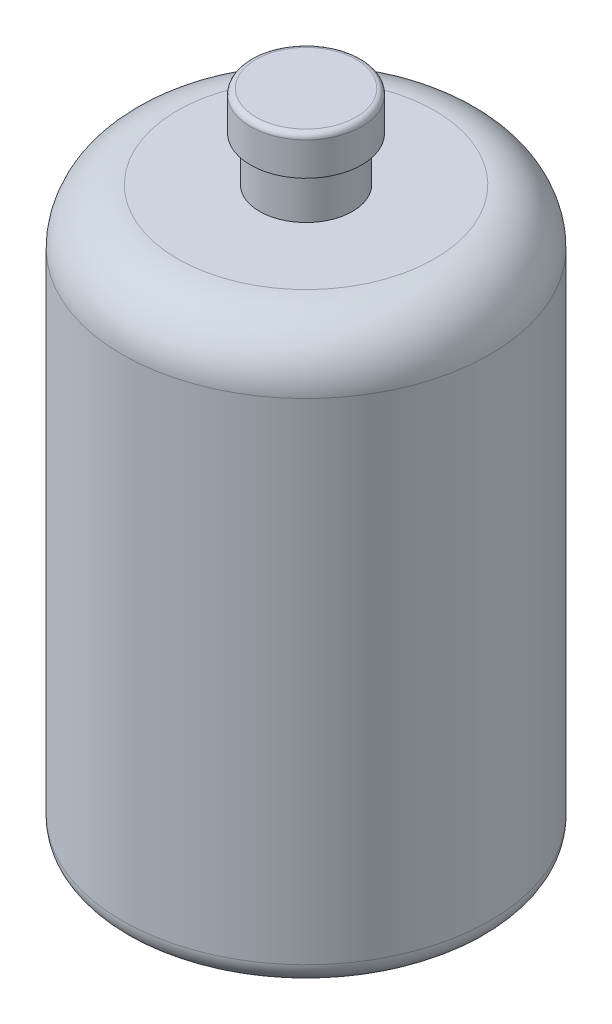
from build123d import *

# Parameters (mm, degrees)
SKETCH1_R           = 33.25
BOSS_EXTRUDE1_DEPTH = 102.7
SKETCH2_R           = 10.05
BOSS_EXTRUDE2_DEPTH = 15.1
FILLET1_R           = 4
FILLET2_R           = 10
FILLET3_R           = 1
SKETCH4_R           = 10.05
SKETCH4_R_2         = 8.4
CUT_EXTRUDE1_DEPTH  = 8.1


with BuildPart() as part:
    # Sketch1 → Boss-Extrude1 (new body)
    with BuildSketch(Plane(origin=(0, 0, 0), x_dir=(1, 0, 0), z_dir=(0, 1, 0))):
        with Locations(Location((0, 0, 0), (0, 0, 270))):
            Circle(SKETCH1_R)
    extrude(amount=BOSS_EXTRUDE1_DEPTH)

    # Sketch2 → Boss-Extrude2 (add)
    with BuildSketch(Plane(origin=(0, 102.7, 0), x_dir=(1, 0, 0), z_dir=(0, 1, 0))):
        with Locations(Location((0, 0, 0), (0, 0, 270))):
            Circle(SKETCH2_R)
    extrude(amount=BOSS_EXTRUDE2_DEPTH)

    # Fillet1
    fillet1_edges = [part.edges().sort_by_distance(p)[0] for p in [
        (0, 0, -33.25),
    ]]
    fillet(fillet1_edges, radius=FILLET1_R)

    # Fillet2
    fillet2_edges = [part.edges().sort_by_distance(p)[0] for p in [
        (0, 102.7, -33.25),
    ]]
    fillet(fillet2_edges, radius=FILLET2_R)

    # Fillet3
    fillet3_edges = [part.edges().sort_by_distance(p)[0] for p in [
        (0, 117.8, -10.05),
    ]]
    fillet(fillet3_edges, radius=FILLET3_R)

    # Sketch4 → Cut-Extrude1 (cut)
    with BuildSketch(Plane(origin=(0, 102.7, 0), x_dir=(1, 0, 0), z_dir=(0, 1, 0))):
        with Locations(Location((0, 0, 0), (0, 0, 270))):
            Circle(SKETCH4_R)
        with Locations(Location((0, 0, 0), (0, 0, 270))):
            Circle(SKETCH4_R_2, mode=Mode.SUBTRACT)
    extrude(amount=CUT_EXTRUDE1_DEPTH, mode=Mode.SUBTRACT)


solid = part.part
